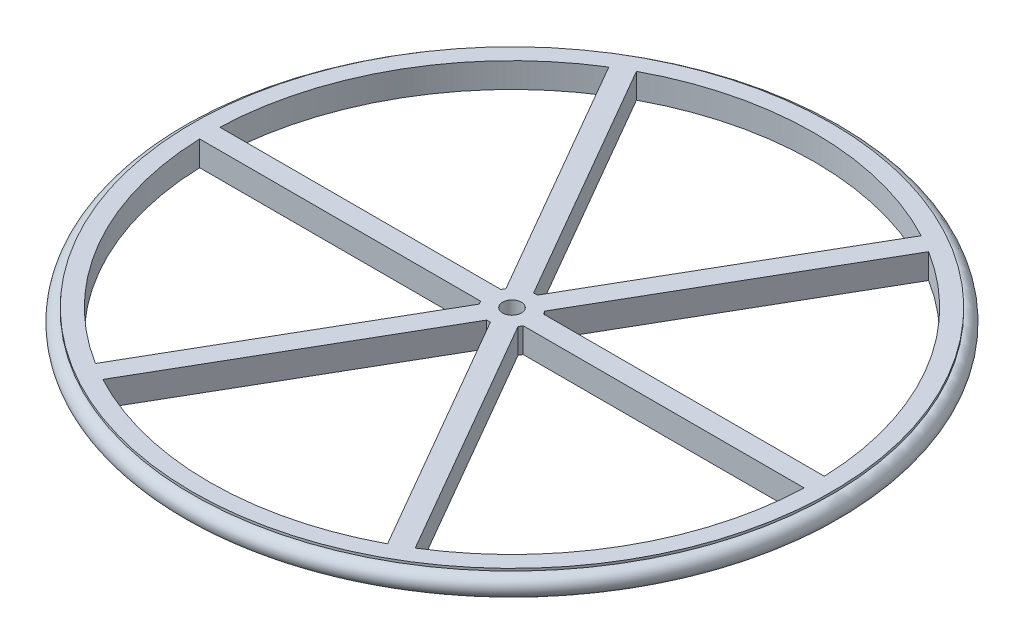
from build123d import *

# Parameters (mm, degrees)
SKETCH1_R           = 135.7
SKETCH1_R_2         = 4
BOSS_EXTRUDE1_DEPTH = 10.6
SKETCH3_R           = 4.3
SKETCH5_R           = 4.3


with BuildPart() as part:
    # Sketch1 → Boss-Extrude1 (new body)
    with BuildSketch(Plane(origin=(0, 0, 0), x_dir=(1, 0, 0), z_dir=(0, 1, 0))):
        with Locations(Location((0, 0, 0), (0, 0, 270))):
            Circle(SKETCH1_R)
        with Locations(Location((0, 0, 0), (0, 0, 270))):
            Circle(SKETCH1_R_2, mode=Mode.SUBTRACT)
        with BuildLine():
            Line((-9.028288874, 4.3), (-128.4, 4.3))
            ThreePointArc((-128.4, 4.3), (-111.259999551, 64.235990691), (-67.923909236, 109.047661846))
            Line((-67.923909236, 109.047661846), (-8.238053673, 5.668727518))
            ThreePointArc((-8.238053673, 5.668727518), (-8.660254038, 5), (-9.028288874, 4.3))
        make_face(mode=Mode.SUBTRACT)
        with BuildLine():
            Line((-9.028288874, -4.3), (-128.4, -4.3))
            ThreePointArc((-128.4, -4.3), (-111.259999551, -64.235990691), (-67.923909236, -109.047661846))
            Line((-67.923909236, -109.047661846), (-8.238053673, -5.668727518))
            ThreePointArc((-8.238053673, -5.668727518), (-8.660254038, -5), (-9.028288874, -4.3))
        make_face(mode=Mode.SUBTRACT)
        with BuildLine():
            Line((-0.790235201, 9.968727518), (-60.476090764, 113.347661846))
            ThreePointArc((-60.476090764, 113.347661846), (0, 128.471981381), (60.476090764, 113.347661846))
            Line((60.476090764, 113.347661846), (0.790235201, 9.968727518))
            ThreePointArc((0.790235201, 9.968727518), (0, 10), (-0.790235201, 9.968727518))
        make_face(mode=Mode.SUBTRACT)
        with BuildLine():
            Line((8.238053673, 5.668727518), (67.923909236, 109.047661846))
            ThreePointArc((67.923909236, 109.047661846), (111.259999551, 64.235990691), (128.4, 4.3))
            Line((128.4, 4.3), (9.028288874, 4.3))
            ThreePointArc((9.028288874, 4.3), (8.660254038, 5), (8.238053673, 5.668727518))
        make_face(mode=Mode.SUBTRACT)
        with BuildLine():
            Line((9.028288874, -4.3), (128.4, -4.3))
            ThreePointArc((128.4, -4.3), (111.259999551, -64.235990691), (67.923909236, -109.047661846))
            Line((67.923909236, -109.047661846), (8.238053673, -5.668727518))
            ThreePointArc((8.238053673, -5.668727518), (8.660254038, -5), (9.028288874, -4.3))
        make_face(mode=Mode.SUBTRACT)
        with BuildLine():
            Line((0.790235201, -9.968727518), (60.476090764, -113.347661846))
            ThreePointArc((60.476090764, -113.347661846), (0, -128.471981381), (-60.476090764, -113.347661846))
            Line((-60.476090764, -113.347661846), (-0.790235201, -9.968727518))
            ThreePointArc((-0.790235201, -9.968727518), (0, -10), (0.790235201, -9.968727518))
        make_face(mode=Mode.SUBTRACT)
    extrude(amount=BOSS_EXTRUDE1_DEPTH)

    # Sketch3 → Cut-Revolve1 (revolve, cut)
    with BuildSketch(Plane.XY, mode=Mode.PRIVATE) as cut_revolve1_sk:
        with Locations((135.7, 5.3)):
            Circle(SKETCH3_R)
    revolve(cut_revolve1_sk.sketch.rotate(Axis((0, 0, 0), (0, 1, 0)), 90), axis=Axis((0, 0, 0), (0, 1, 0)), mode=Mode.SUBTRACT)

    # Sketch5 → Revolve1 (revolve)
    with BuildSketch(Plane(origin=(0, 0, 0), x_dir=(0, 0, -1), z_dir=(1, 0, 0))):
        with Locations((135.7, 5.3)):
            Circle(SKETCH5_R)
    revolve(axis=Axis((0, 0, 0), (0, 1, 0)))


solid = part.part
